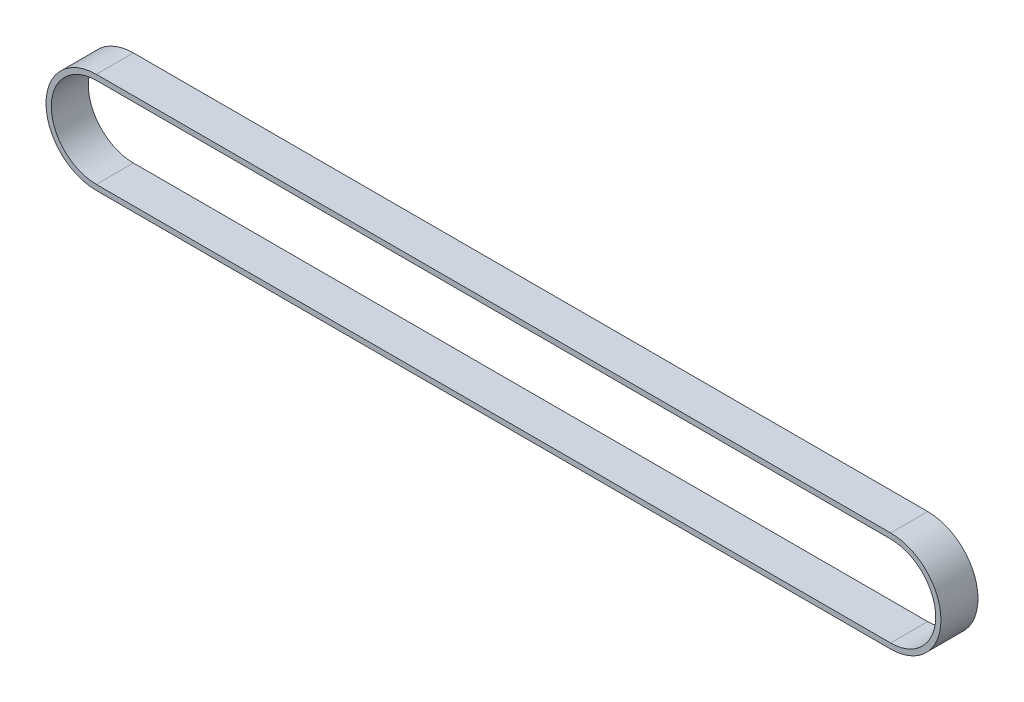
from build123d import *

# Parameters (mm, degrees)
EXTRUDE_1_DEPTH = 14


with BuildPart() as part:
    # 草图1 → 拉伸-薄壁1 (new body)
    with BuildSketch(Plane.XY):
        with BuildLine():
            Line((286.082901554, -19), (-13.917098446, -19))
            ThreePointArc((-13.917098446, -19), (-32.917098446, 0), (-13.917098446, 19))
            Line((-13.917098446, 19), (286.082901554, 19))
            ThreePointArc((286.082901554, 19), (305.082901554, 0), (286.082901554, -19))
        make_face()
        with BuildLine():
            Line((286.082901554, -17), (-13.917098446, -17))
            ThreePointArc((-13.917098446, -17), (-30.917098446, 0), (-13.917098446, 17))
            Line((-13.917098446, 17), (286.082901554, 17))
            ThreePointArc((286.082901554, 17), (303.082901554, 0), (286.082901554, -17))
        make_face(mode=Mode.SUBTRACT)
    extrude(amount=EXTRUDE_1_DEPTH)


solid = part.part
